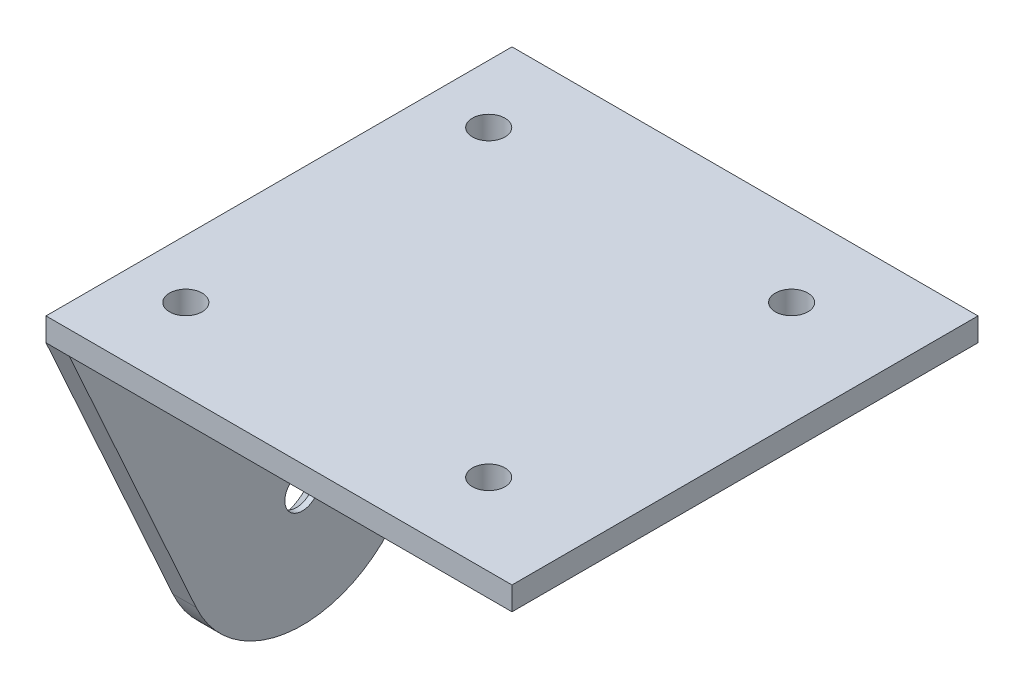
from build123d import *

# Parameters (mm, degrees)
SKETCH_1_W        = 40
SKETCH_1_H        = 40
SKETCH_1_R        = 1.4
EXTRUDE_494_DEPTH = 2
SKETCH_2_R        = 1.5
EXTRUDE_1_DEPTH   = 2
CHAMFER_1_SIZE    = 1.5


with BuildPart() as part:
    # Эскиз1 → Extrude 494 (new body)
    with BuildSketch(Plane(origin=(0, 0, 0), x_dir=(1, 0, 0), z_dir=(0, 1, 0))):
        with Locations((10.449336465, 3.276993421)):
            Rectangle(SKETCH_1_W, SKETCH_1_H)
        with Locations((-4.550663535, 16.276993421)):
            Circle(SKETCH_1_R, mode=Mode.SUBTRACT)
        with Locations((21.449336465, 16.276993421)):
            Circle(SKETCH_1_R, mode=Mode.SUBTRACT)
        with Locations((21.449336465, -9.723006579)):
            Circle(SKETCH_1_R, mode=Mode.SUBTRACT)
        with Locations((-4.550663535, -9.723006579)):
            Circle(SKETCH_1_R, mode=Mode.SUBTRACT)
    extrude(amount=EXTRUDE_494_DEPTH)

    # Эскиз2 → Боковая с 1 отверстием (add)
    with BuildSketch(Plane.ZY.offset(9.550663535)):
        with BuildLine():
            Line((-12.391371699, -24.114378278), (-23.276993421, 0))
            Line((-23.276993421, 0), (16.723006579, 0))
            Line((16.723006579, 0), (5.837384857, -24.114378278))
            ThreePointArc((5.837384857, -24.114378278), (-3.276993421, -30), (-12.391371699, -24.114378278))
        make_face()
        with Locations((-3.276993421, -20)):
            Circle(SKETCH_2_R, mode=Mode.SUBTRACT)
    extrude(amount=-EXTRUDE_1_DEPTH)

    # Фаска 1 отвертие
    chamfer_1_edges = [part.edges().sort_by_distance(p)[0] for p in [
        (-9.550663535, -20, -4.776993421),
    ]]
    chamfer(chamfer_1_edges, length=CHAMFER_1_SIZE)


solid = part.part
